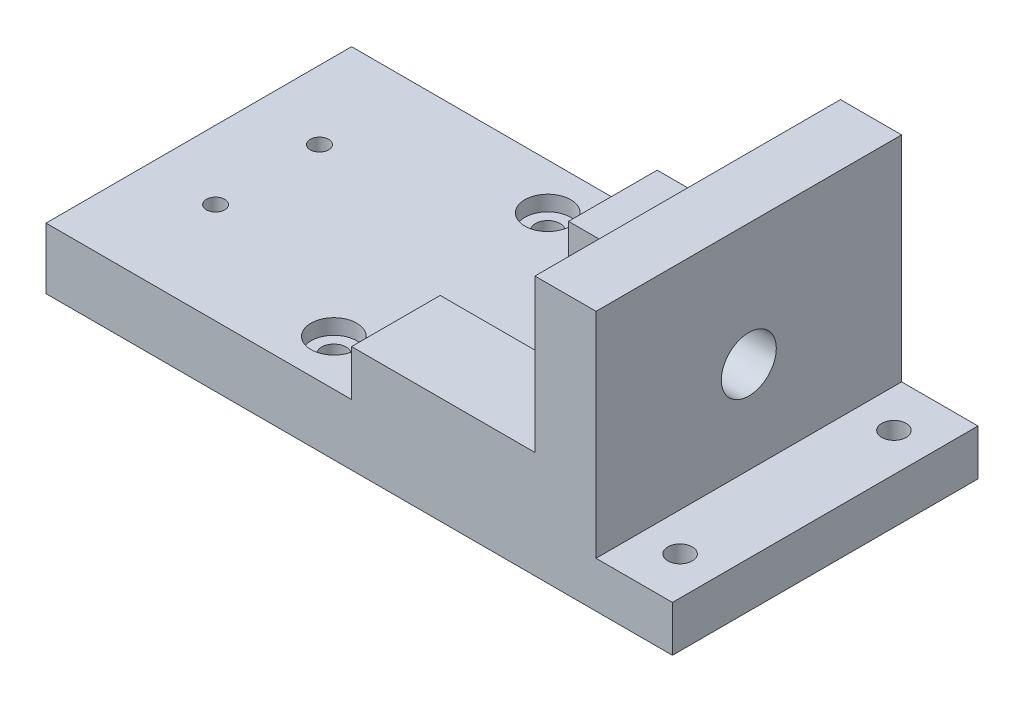
from build123d import *

# Parameters (mm, degrees)
BOSS_EXTRUDE1_DEPTH = 50
SKETCH2_R           = 9
CUT_EXTRUDE1_DEPTH  = 206.243757518
SKETCH3_W           = 60
SKETCH3_H           = 42
CUT_EXTRUDE2_DEPTH  = 15
SKETCH4_R           = 3
SKETCH4_R_2         = 4
CUT_EXTRUDE3_DEPTH  = 221.794021658
SKETCH4_4_R         = 7.5
CUT_EXTRUDE4_DEPTH  = 5


with BuildPart() as part:
    # Sketch1 → Boss-Extrude1 (new, symmetric)
    with BuildSketch(Plane.XY):
        Polygon((0, 0), (0, 15), (-25, 15), (-25, 85), (-45, 85), (-45, 35), (-105, 35), (-105, 20), (-205, 20), (-205, 0), align=None)
    extrude(amount=BOSS_EXTRUDE1_DEPTH, both=True)

    # Sketch2 → Cut-Extrude1 (cut, through all)
    with BuildSketch(Plane(origin=(-25, 0, 0), x_dir=(0, 0, -1), z_dir=(1, 0, 0))):
        with Locations((0, 45)):
            Circle(SKETCH2_R)
    extrude(amount=-CUT_EXTRUDE1_DEPTH, mode=Mode.SUBTRACT)

    # Sketch3 → Cut-Extrude2 (cut)
    with BuildSketch(Plane(origin=(0, 35, 0), x_dir=(1, 0, 0), z_dir=(0, 1, 0))):
        with Locations((-75, 0)):
            Rectangle(SKETCH3_W, SKETCH3_H)
    extrude(amount=-CUT_EXTRUDE2_DEPTH, mode=Mode.SUBTRACT)

    # Sketch4 → Cut-Extrude3 (cut, through all)
    with BuildSketch(Plane(origin=(0, 20, 0), x_dir=(1, 0, 0), z_dir=(0, 1, 0))):
        with Locations(Location((-182.5, 17, 0), (0, 0, 180))):
            Circle(SKETCH4_R)
        with Locations(Location((-125.788008323, 35, 0), (0, 0, 180))):
            Circle(SKETCH4_R_2)
        with Locations(Location((-12.5, 35, 0), (0, 0, 180))):
            Circle(SKETCH4_R_2)
        with Locations((-12.5, -35)):
            Circle(SKETCH4_R_2)
        with Locations((-125.788008323, -35)):
            Circle(SKETCH4_R_2)
        with Locations((-182.5, -17)):
            Circle(SKETCH4_R)
    extrude(amount=-CUT_EXTRUDE3_DEPTH, mode=Mode.SUBTRACT)

    # Sketch4<4> → Cut-Extrude4 (cut)
    with BuildSketch(Plane(origin=(0, 20, 0), x_dir=(1, 0, 0), z_dir=(0, 1, 0))):
        with Locations(Location((-125.788008323, 35, 0), (0, 0, 180))):
            Circle(SKETCH4_4_R)
        with Locations((-125.788008323, -35)):
            Circle(SKETCH4_4_R)
    extrude(amount=-CUT_EXTRUDE4_DEPTH, mode=Mode.SUBTRACT)


solid = part.part
